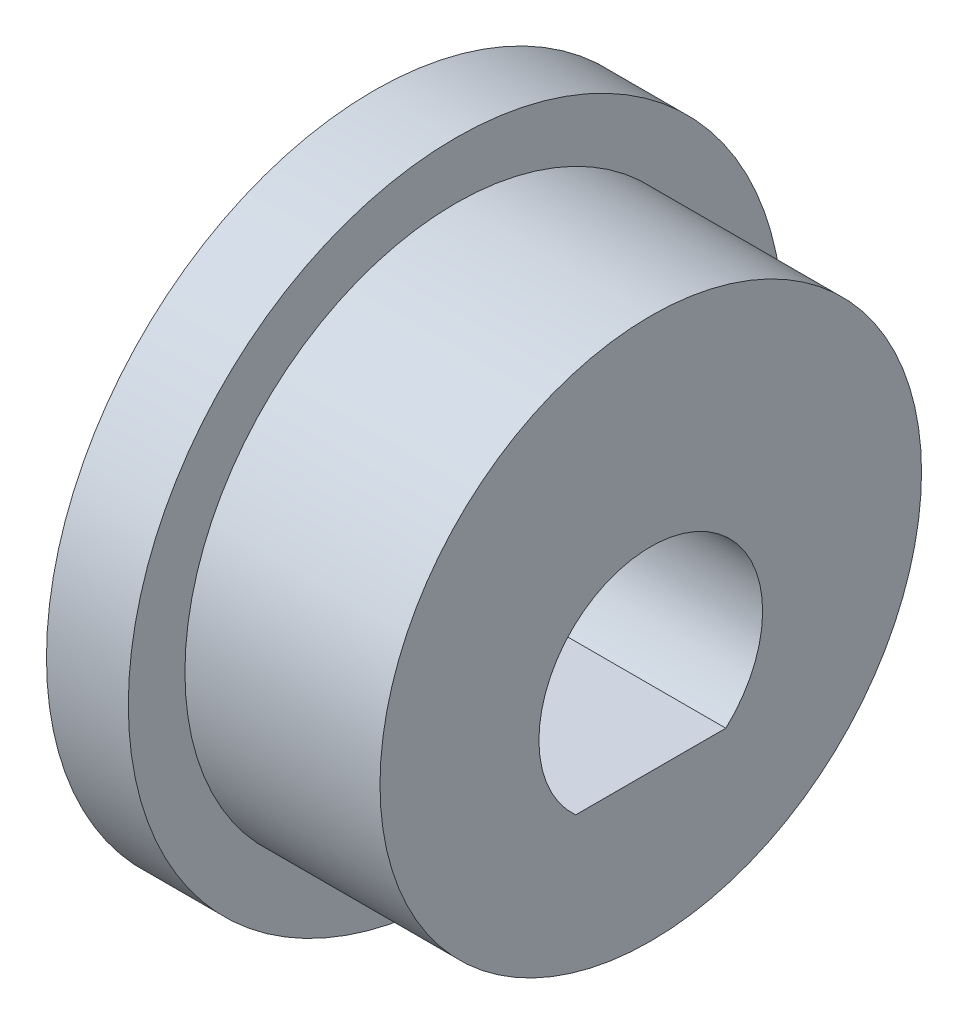
from build123d import *

# Parameters (mm, degrees)
SKIZZE1_R                            = 9.925
AUFSATZ_LINEAR_AUSTRAGEN1_DEPTH      = 7.15
SKIZZE2_R                            = 12
AUFSATZ_LINEAR_AUSTRAGEN2_DEPTH      = 3
SCHNITT_LINEAR_AUSTRAGEN1_DEPTH      = 21.718892345
SCHNITT_LINEAR_AUSTRAGEN1_DEPTH_BACK = 21.718892345


with BuildPart() as part:
    # Skizze1 → Aufsatz-Linear austragen1 (new body)
    with BuildSketch(Plane(origin=(0, 0, 0), x_dir=(0, 0, -1), z_dir=(1, 0, 0))):
        with Locations((0, 1.5)):
            Circle(SKIZZE1_R)
    extrude(amount=AUFSATZ_LINEAR_AUSTRAGEN1_DEPTH)

    # Skizze2 → Aufsatz-Linear austragen2 (add)
    with BuildSketch(Plane.ZY):
        with Locations((0, 1.5)):
            Circle(SKIZZE2_R)
    extrude(amount=AUFSATZ_LINEAR_AUSTRAGEN2_DEPTH)

    # Skizze3 → Schnitt-Linear austragen1 (cut, two sides: drawn at the far end of the back side and taken through both)
    with BuildSketch(Plane(origin=(7.15, 0, 0), x_dir=(0, 0, -1), z_dir=(1, 0, 0)).offset(-SCHNITT_LINEAR_AUSTRAGEN1_DEPTH_BACK)):
        with BuildLine():
            Line((2.75, -3.04097024), (-2.75, -3.04097024))
            ThreePointArc((-2.75, -3.04097024), (0, 4.1), (2.75, -3.04097024))
        make_face()
    extrude(amount=SCHNITT_LINEAR_AUSTRAGEN1_DEPTH + SCHNITT_LINEAR_AUSTRAGEN1_DEPTH_BACK, mode=Mode.SUBTRACT)


solid = part.part
